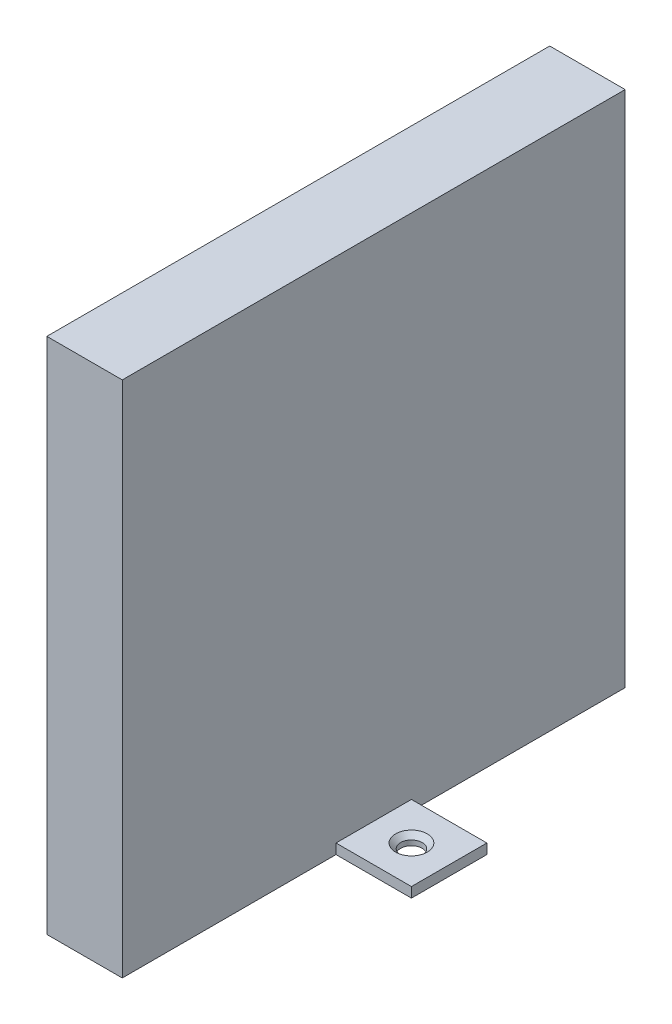
from build123d import *

# Parameters (mm, degrees)
SKETCH1_W           = 15
SKETCH1_H           = 100
BOSS_EXTRUDE1_DEPTH = 103
SKETCH2_W           = 15
SKETCH2_H           = 2
BOSS_EXTRUDE2_DEPTH = 15
SKETCH3_W           = 15
SKETCH3_H           = 2
BOSS_EXTRUDE3_DEPTH = 15
SKETCH4_R           = 2.15
CUT_EXTRUDE1_DEPTH  = 15
CHAMFER1_SIZE       = 1


with BuildPart() as part:
    # Sketch1 → Boss-Extrude1 (new body)
    with BuildSketch(Plane(origin=(0, 0, 0), x_dir=(1, 0, 0), z_dir=(0, 1, 0))):
        with Locations((7.5, 50)):
            Rectangle(SKETCH1_W, SKETCH1_H)
    extrude(amount=BOSS_EXTRUDE1_DEPTH)

    # Sketch2 → Boss-Extrude2 (add)
    with BuildSketch(Plane.ZY):
        with Locations((-50, 1)):
            Rectangle(SKETCH2_W, SKETCH2_H)
    extrude(amount=BOSS_EXTRUDE2_DEPTH)

    # Sketch3 → Boss-Extrude3 (add)
    with BuildSketch(Plane(origin=(15, 0, 0), x_dir=(0, 0, -1), z_dir=(1, 0, 0))):
        with Locations((50, 1)):
            Rectangle(SKETCH3_W, SKETCH3_H)
    extrude(amount=BOSS_EXTRUDE3_DEPTH)

    # Sketch4 → Cut-Extrude1 (cut)
    with BuildSketch(Plane(origin=(0, 2, 0), x_dir=(1, 0, 0), z_dir=(0, 1, 0))):
        with Locations(Location((-7.5, 50, 0), (0, 0, 270))):
            Circle(SKETCH4_R)
        with Locations(Location((22.5, 50, 0), (0, 0, 270))):
            Circle(SKETCH4_R)
    extrude(amount=-CUT_EXTRUDE1_DEPTH, mode=Mode.SUBTRACT)

    # Chamfer1
    chamfer1_edges = [part.edges().sort_by_distance(p)[0] for p in [
        (-7.5, 2, -52.15),
        (22.5, 2, -52.15),
    ]]
    chamfer(chamfer1_edges, length=CHAMFER1_SIZE)


solid = part.part
